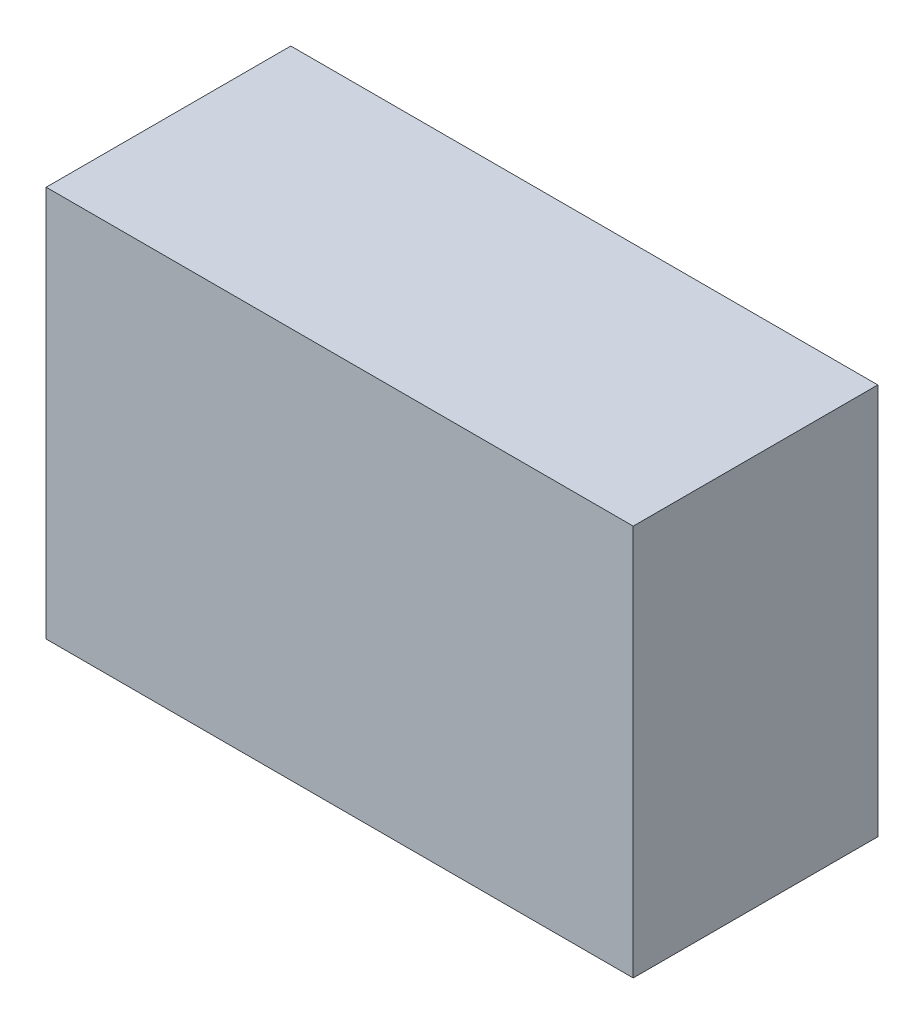
from build123d import *

# Parameters (mm, degrees)
ESQUISSE1_W      = 60
ESQUISSE1_H      = 40
EXTRUSION1_DEPTH = 25


with BuildPart() as part:
    # Esquisse1 → Extrusion1 (new body)
    with BuildSketch(Plane.XY):
        with Locations((-30, 20)):
            Rectangle(ESQUISSE1_W, ESQUISSE1_H)
    extrude(amount=EXTRUSION1_DEPTH)


solid = part.part
